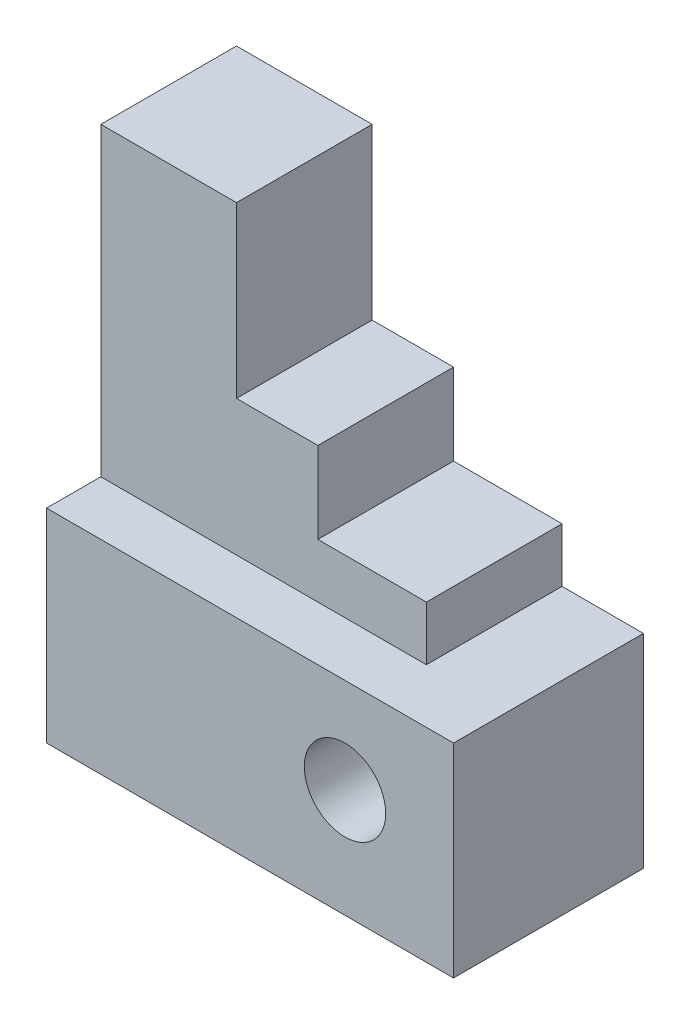
from build123d import *

# Parameters (mm, degrees)
CROQUIS1_R              = 6
SALIENTE_EXTRUIR1_DEPTH = 28
SALIENTE_EXTRUIR2_DEPTH = 20


with BuildPart() as part:
    # Croquis1 → Saliente-Extruir1 (new body)
    with BuildSketch(Plane.XY):
        Polygon((0, 6.177514793), (0, 3.692307692), (0, 0), (60, 0), (60, 30), (48, 30), (45.798816568, 30), (0, 30), align=None)
        with Locations((44, 16)):
            Circle(CROQUIS1_R, mode=Mode.SUBTRACT)
    extrude(amount=SALIENTE_EXTRUIR1_DEPTH)

    # Croquis1<5> → Saliente-Extruir2 (add)
    with BuildSketch(Plane.XY):
        Polygon((0, 38), (0, 30), (45.798816568, 30), (48, 30), (48, 38), (32, 38), (32, 50), (20, 50), (20, 75), (0, 75), (0, 50), align=None)
    extrude(amount=SALIENTE_EXTRUIR2_DEPTH)


solid = part.part
